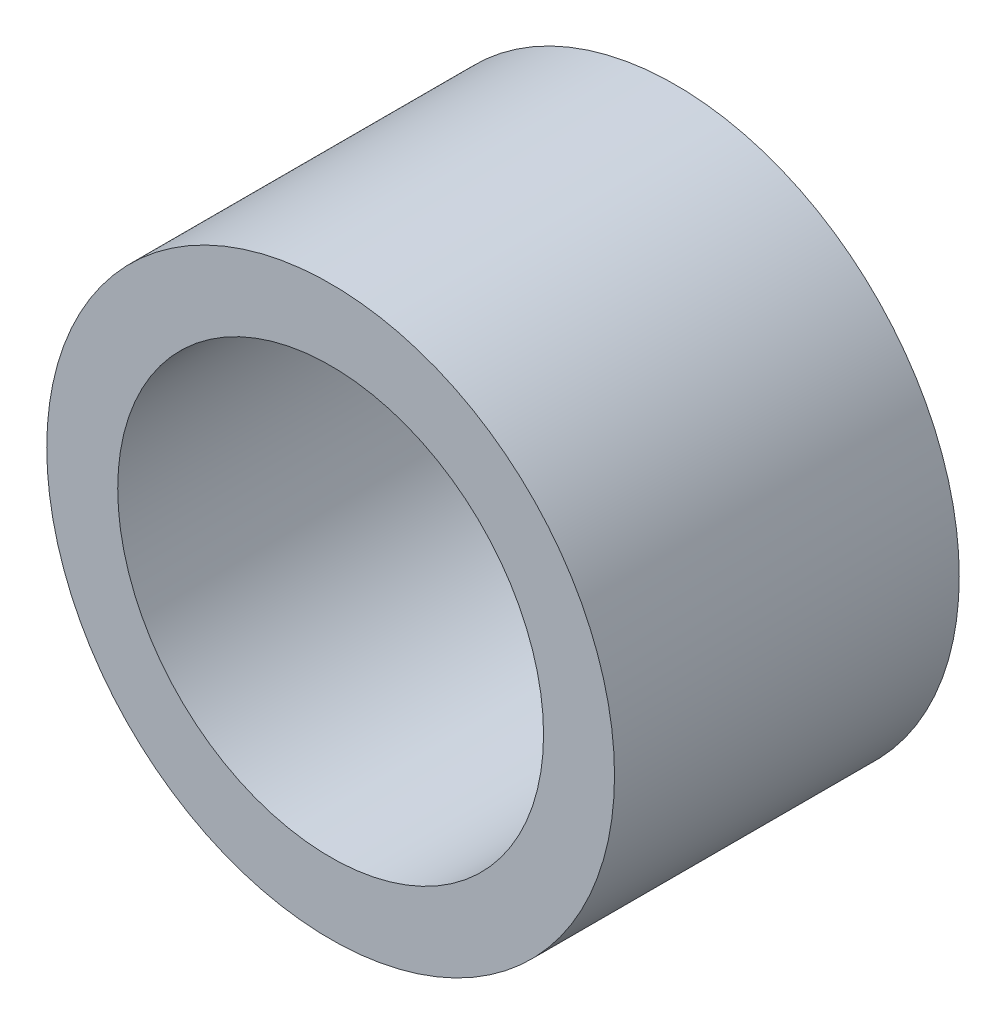
from build123d import *

# Parameters (mm, degrees)
SKETCH1_R           = 7
SKETCH1_R_2         = 5.25
BOSS_EXTRUDE1_DEPTH = 8.5


with BuildPart() as part:
    # Sketch1 → Boss-Extrude1 (new body)
    with BuildSketch(Plane.XY):
        Circle(SKETCH1_R)
        Circle(SKETCH1_R_2, mode=Mode.SUBTRACT)
    extrude(amount=BOSS_EXTRUDE1_DEPTH)


solid = part.part
